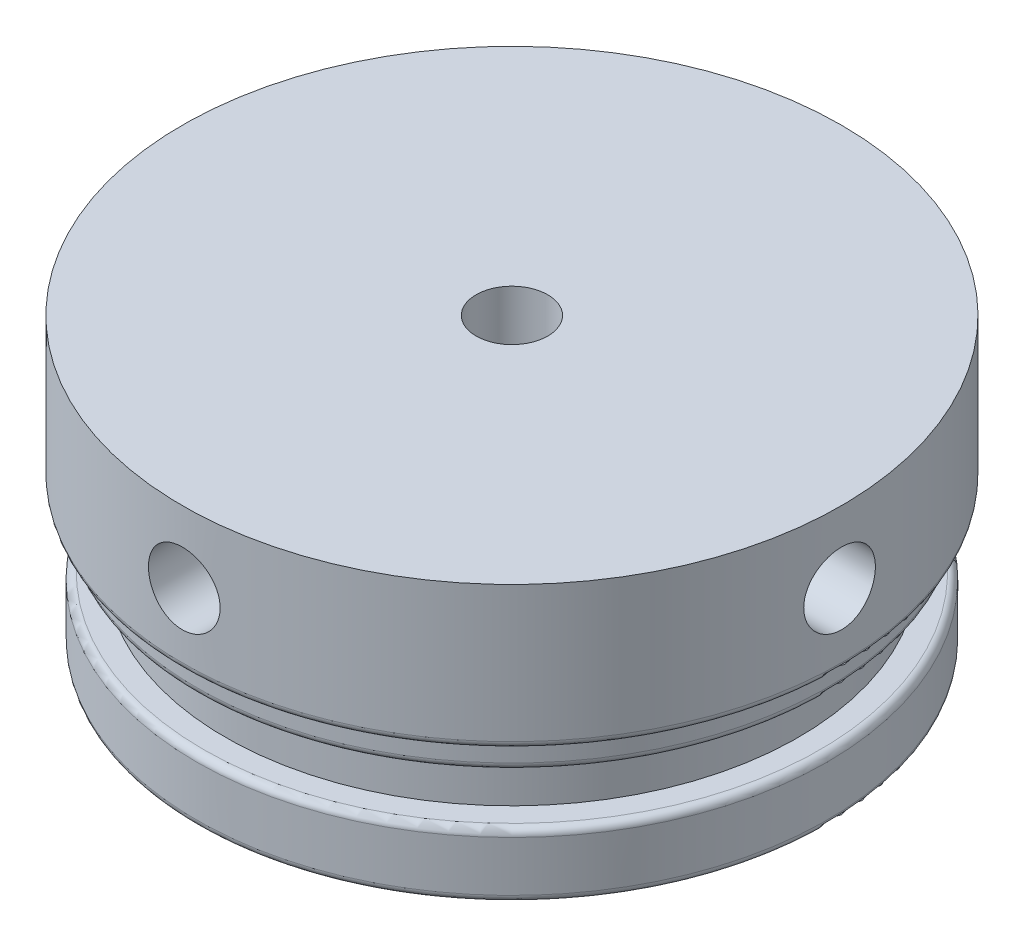
from build123d import *

# Parameters (mm, degrees)
SKETCH_3_R          = 2.5
CUT_EXTRUDE_1_DEPTH = 6
SKETCH_4_R          = 2.5
CUT_EXTRUDE_2_DEPTH = 6
CUT_EXTRUDE_START   = -6
SKETCH_5_R          = 2.5
CUT_EXTRUDE_3_DEPTH = 6
SKETCH_6_R          = 2.5
CUT_EXTRUDE_4_DEPTH = 6
SKETCH_7_R          = 2.5
CUT_EXTRUDE_5_DEPTH = 6
FILLET_1_R          = 0.5
FILLET_2_R          = 0.5
FILLET_3_R          = 0.5
FILLET_4_R          = 0.5


with BuildPart() as part:
    # 스케치2 → 회전1 (revolve)
    with BuildSketch(Plane.XY, mode=Mode.PRIVATE) as revolve_1_sk:
        Polygon((0, 0), (0, 20), (23, 20), (23, 10), (22, 10), (22, 8), (20, 8), (20, 4.5), (22, 4.5), (22, 0), align=None)
    revolve(revolve_1_sk.sketch.rotate(Axis((0, 0, 0), (0, 1, 0)), 90), axis=Axis((0, 0, 0), (0, 1, 0)))

    # 스케치3 → 컷-돌출1 (cut)
    with BuildSketch(Plane.ZY.offset(23)):
        with Locations((0, 15)):
            Circle(SKETCH_3_R)
    extrude(amount=-CUT_EXTRUDE_1_DEPTH, mode=Mode.SUBTRACT)

    # 스케치4 → 컷-돌출2 (cut)
    with BuildSketch(Plane(origin=(0, 0, -23), x_dir=(-1, 0, 0), z_dir=(0, 0, -1))):
        with Locations((0, 15)):
            Circle(SKETCH_4_R)
    extrude(amount=-CUT_EXTRUDE_2_DEPTH, mode=Mode.SUBTRACT)

    # 스케치5 → 컷-돌출3 (cut)
    with BuildSketch(Plane(origin=(23, 0, 0), x_dir=(0, 0, -1), z_dir=(1, 0, 0)).offset(CUT_EXTRUDE_START)):
        with Locations(Location((0, 15, 0), (0, 0, 180))):
            Circle(SKETCH_5_R)
    extrude(amount=CUT_EXTRUDE_3_DEPTH, mode=Mode.SUBTRACT)

    # 스케치6 → 컷-돌출4 (cut)
    with BuildSketch(Plane.XY.offset(23).offset(CUT_EXTRUDE_START)):
        with Locations(Location((0, 15, 0), (0, 0, 180))):
            Circle(SKETCH_6_R)
    extrude(amount=CUT_EXTRUDE_4_DEPTH, mode=Mode.SUBTRACT)

    # 스케치7 → 컷-돌출5 (cut)
    with BuildSketch(Plane(origin=(0, 20, 0), x_dir=(1, 0, 0), z_dir=(0, 1, 0))):
        with Locations(Location((0, 0, 0), (0, 0, 270))):
            Circle(SKETCH_7_R)
    extrude(amount=-CUT_EXTRUDE_5_DEPTH, mode=Mode.SUBTRACT)

    # 필렛1
    fillet_1_edges = [part.edges().sort_by_distance(p)[0] for p in [
        (0, 8, 22),
    ]]
    fillet(fillet_1_edges, radius=FILLET_1_R)

    # 필렛2
    fillet_2_edges = [part.edges().sort_by_distance(p)[0] for p in [
        (0, 4.5, 22),
    ]]
    fillet(fillet_2_edges, radius=FILLET_2_R)

    # 필렛3
    fillet_3_edges = [part.edges().sort_by_distance(p)[0] for p in [
        (0, 0, 22),
    ]]
    fillet(fillet_3_edges, radius=FILLET_3_R)

    # 필렛4
    fillet_4_edges = [part.edges().sort_by_distance(p)[0] for p in [
        (0, 10, 23),
    ]]
    fillet(fillet_4_edges, radius=FILLET_4_R)


solid = part.part
